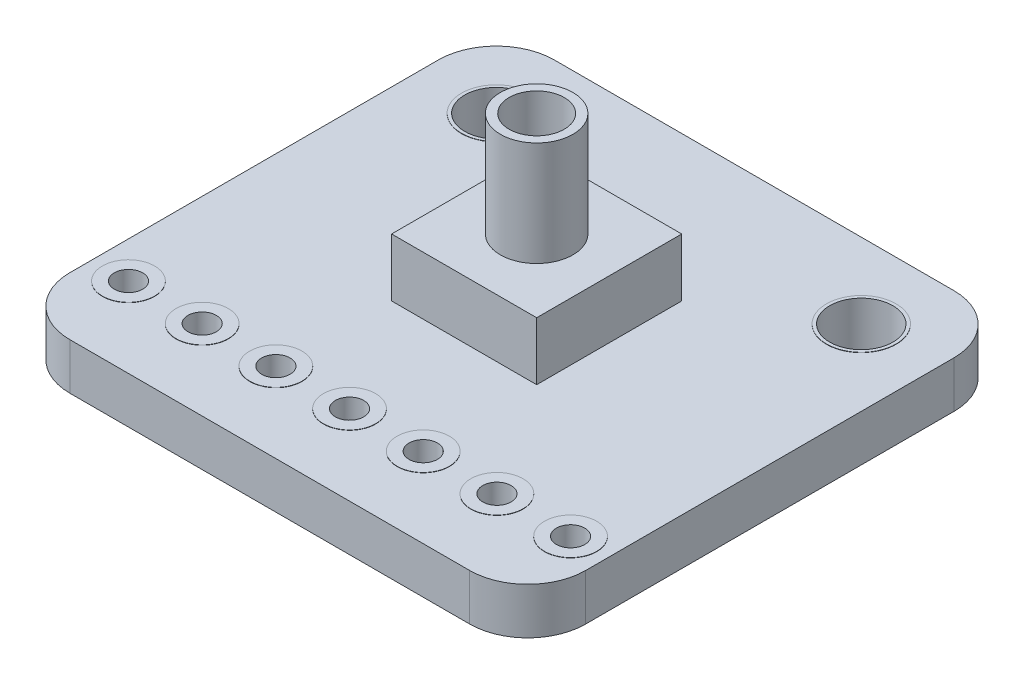
from build123d import *

# Parameters (mm, degrees)
BOSS_EXTRUDE1_DEPTH = 1.6
SKETCH2_R           = 1.1
SKETCH2_R_2         = 0.5
CUT_EXTRUDE1_DEPTH  = 1.6
SKETCH3_R           = 1.2
SKETCH3_R_2         = 1.09
SKETCH3_R_3         = 0.9
SKETCH3_R_4         = 0.49
BOSS_EXTRUDE2_DEPTH = 1.62
SKETCH5_W           = 5
SKETCH5_H           = 5
BOSS_EXTRUDE3_DEPTH = 2
SKETCH6_R           = 1.25
SKETCH6_R_2         = 0.95
BOSS_EXTRUDE4_DEPTH = 3.6


with BuildPart() as part:
    # Sketch1 → Boss-Extrude1 (new body)
    with BuildSketch(Plane(origin=(0, 0, 0), x_dir=(1, 0, 0), z_dir=(0, 1, 0))):
        with BuildLine():
            Line((-6.89, 8.35), (6.89, 8.35))
            ThreePointArc((6.89, 8.35), (8.304213562, 7.764213562), (8.89, 6.35))
            Line((8.89, 6.35), (8.89, -6.35))
            ThreePointArc((8.89, -6.35), (8.304213562, -7.764213562), (6.89, -8.35))
            Line((6.89, -8.35), (-6.89, -8.35))
            ThreePointArc((-6.89, -8.35), (-8.304213562, -7.764213562), (-8.89, -6.35))
            Line((-8.89, -6.35), (-8.89, 6.35))
            ThreePointArc((-8.89, 6.35), (-8.304213562, 7.764213562), (-6.89, 8.35))
        make_face()
    extrude(amount=BOSS_EXTRUDE1_DEPTH)

    # Sketch2 → Cut-Extrude1 (cut)
    with BuildSketch(Plane(origin=(0, 1.6, 0), x_dir=(1, 0, 0), z_dir=(0, 1, 0))):
        with Locations(Location((-6.29, 5.75, 0), (0, 0, 270))):
            Circle(SKETCH2_R)
        with Locations(Location((6.29, 5.75, 0), (0, 0, 90))):
            Circle(SKETCH2_R)
        with Locations(Location((-7.62, -5.6, 0), (0, 0, 270))):
            Circle(SKETCH2_R_2)
        with Locations(Location((-5.08, -5.6, 0), (0, 0, 270))):
            Circle(SKETCH2_R_2)
        with Locations(Location((-2.54, -5.6, 0), (0, 0, 270))):
            Circle(SKETCH2_R_2)
        with Locations(Location((0, -5.6, 0), (0, 0, 270))):
            Circle(SKETCH2_R_2)
        with Locations(Location((2.54, -5.6, 0), (0, 0, 270))):
            Circle(SKETCH2_R_2)
        with Locations(Location((5.08, -5.6, 0), (0, 0, 270))):
            Circle(SKETCH2_R_2)
        with Locations(Location((7.62, -5.6, 0), (0, 0, 270))):
            Circle(SKETCH2_R_2)
    extrude(amount=-CUT_EXTRUDE1_DEPTH, mode=Mode.SUBTRACT)

    # Sketch3 → Boss-Extrude2 (add)
    # profile 1 of 9: a face of its own
    with BuildSketch(Plane(origin=(0, 1.61, 0), x_dir=(1, 0, 0), z_dir=(0, 1, 0))):
        with Locations(Location((-6.29, 5.75, 0), (0, 0, 270))):
            Circle(SKETCH3_R)
        with Locations(Location((-6.29, 5.75, 0), (0, 0, 270))):
            Circle(SKETCH3_R_2, mode=Mode.SUBTRACT)
    # profile 2 of 9: a face of its own
    with BuildSketch(Plane(origin=(0, 1.61, 0), x_dir=(1, 0, 0), z_dir=(0, 1, 0))):
        with Locations(Location((6.29, 5.75, 0), (0, 0, 270))):
            Circle(SKETCH3_R)
        with Locations(Location((6.29, 5.75, 0), (0, 0, 270))):
            Circle(SKETCH3_R_2, mode=Mode.SUBTRACT)
    # profile 3 of 9: a face of its own
    with BuildSketch(Plane(origin=(0, 1.61, 0), x_dir=(1, 0, 0), z_dir=(0, 1, 0))):
        with Locations(Location((7.62, -5.6, 0), (0, 0, 270))):
            Circle(SKETCH3_R_3)
        with Locations(Location((7.62, -5.6, 0), (0, 0, 270))):
            Circle(SKETCH3_R_4, mode=Mode.SUBTRACT)
    # profile 4 of 9: a face of its own
    with BuildSketch(Plane(origin=(0, 1.61, 0), x_dir=(1, 0, 0), z_dir=(0, 1, 0))):
        with Locations(Location((5.08, -5.6, 0), (0, 0, 270))):
            Circle(SKETCH3_R_3)
        with Locations(Location((5.08, -5.6, 0), (0, 0, 270))):
            Circle(SKETCH3_R_4, mode=Mode.SUBTRACT)
    # profile 5 of 9: a face of its own
    with BuildSketch(Plane(origin=(0, 1.61, 0), x_dir=(1, 0, 0), z_dir=(0, 1, 0))):
        with Locations(Location((2.54, -5.6, 0), (0, 0, 270))):
            Circle(SKETCH3_R_3)
        with Locations(Location((2.54, -5.6, 0), (0, 0, 270))):
            Circle(SKETCH3_R_4, mode=Mode.SUBTRACT)
    # profile 6 of 9: a face of its own
    with BuildSketch(Plane(origin=(0, 1.61, 0), x_dir=(1, 0, 0), z_dir=(0, 1, 0))):
        with Locations(Location((0, -5.6, 0), (0, 0, 270))):
            Circle(SKETCH3_R_3)
        with Locations(Location((0, -5.6, 0), (0, 0, 270))):
            Circle(SKETCH3_R_4, mode=Mode.SUBTRACT)
    # profile 7 of 9: a face of its own
    with BuildSketch(Plane(origin=(0, 1.61, 0), x_dir=(1, 0, 0), z_dir=(0, 1, 0))):
        with Locations(Location((-2.54, -5.6, 0), (0, 0, 270))):
            Circle(SKETCH3_R_3)
        with Locations(Location((-2.54, -5.6, 0), (0, 0, 270))):
            Circle(SKETCH3_R_4, mode=Mode.SUBTRACT)
    # profile 8 of 9: a face of its own
    with BuildSketch(Plane(origin=(0, 1.61, 0), x_dir=(1, 0, 0), z_dir=(0, 1, 0))):
        with Locations(Location((-5.08, -5.6, 0), (0, 0, 270))):
            Circle(SKETCH3_R_3)
        with Locations(Location((-5.08, -5.6, 0), (0, 0, 270))):
            Circle(SKETCH3_R_4, mode=Mode.SUBTRACT)
    # profile 9 of 9: a face of its own
    with BuildSketch(Plane(origin=(0, 1.61, 0), x_dir=(1, 0, 0), z_dir=(0, 1, 0))):
        with Locations(Location((-7.62, -5.6, 0), (0, 0, 270))):
            Circle(SKETCH3_R_3)
        with Locations(Location((-7.62, -5.6, 0), (0, 0, 270))):
            Circle(SKETCH3_R_4, mode=Mode.SUBTRACT)
    extrude(amount=-BOSS_EXTRUDE2_DEPTH)

    # Sketch5 → Boss-Extrude3 (add)
    with BuildSketch(Plane(origin=(0, 1.6, 0), x_dir=(1, 0, 0), z_dir=(0, 1, 0))):
        with Locations((0, 0.85)):
            Rectangle(SKETCH5_W, SKETCH5_H)
    extrude(amount=BOSS_EXTRUDE3_DEPTH)

    # Sketch6 → Boss-Extrude4 (add)
    with BuildSketch(Plane(origin=(0, 3.6, 0), x_dir=(1, 0, 0), z_dir=(0, 1, 0))):
        with Locations(Location((0, 0.85, 0), (0, 0, 270))):
            Circle(SKETCH6_R)
        with Locations(Location((0, 0.85, 0), (0, 0, 270))):
            Circle(SKETCH6_R_2, mode=Mode.SUBTRACT)
    extrude(amount=BOSS_EXTRUDE4_DEPTH)


solid = part.part
